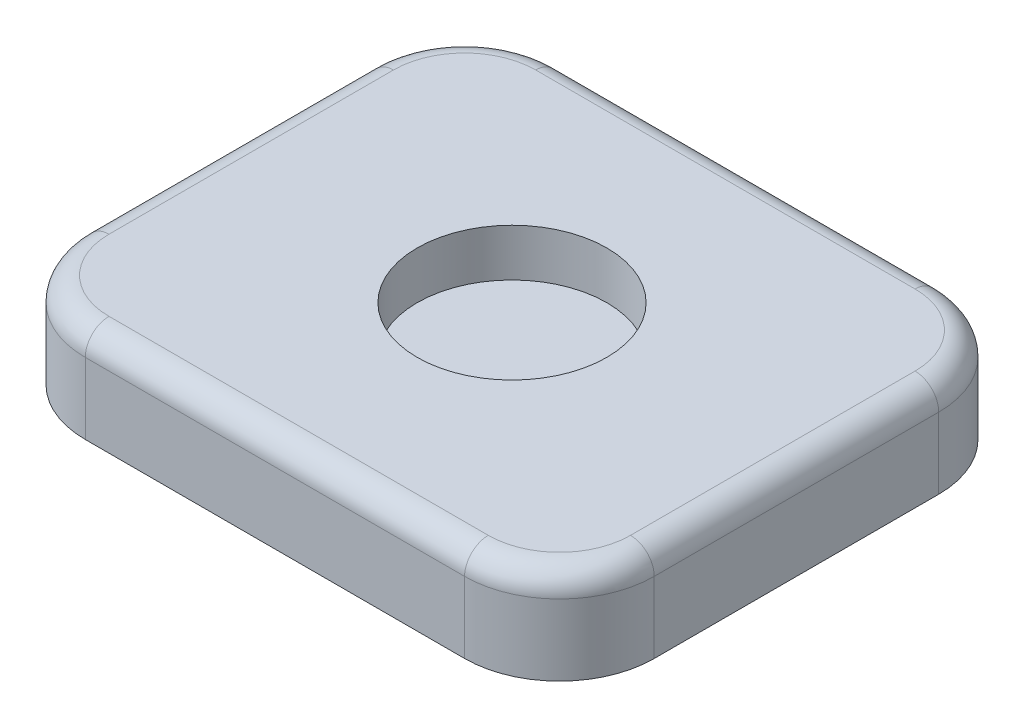
from build123d import *

# Parameters (mm, degrees)
SKETCH2_W           = 120
SKETCH2_H           = 100
SKETCH2_R           = 20
BOSS_EXTRUDE1_DEPTH = 10
SKETCH3_W           = 120
SKETCH3_H           = 100
BOSS_EXTRUDE2_DEPTH = 10
FILLET1_R           = 20
FILLET2_R           = 5


with BuildPart() as part:
    # Sketch2 → Boss-Extrude1 (new body)
    with BuildSketch(Plane(origin=(0, 0, 0), x_dir=(1, 0, 0), z_dir=(0, 1, 0))):
        Rectangle(SKETCH2_W, SKETCH2_H)
        with Locations(Location((0, 0, 0), (0, 0, 270))):
            Circle(SKETCH2_R, mode=Mode.SUBTRACT)
    extrude(amount=BOSS_EXTRUDE1_DEPTH)

    # Sketch3 → Boss-Extrude2 (add)
    with BuildSketch(Plane.XZ):
        Rectangle(SKETCH3_W, SKETCH3_H)
    extrude(amount=BOSS_EXTRUDE2_DEPTH)

    # Fillet1
    fillet1_edges = [part.edges().sort_by_distance(p)[0] for p in [
        (60, 0, 50),
        (-60, 0, 50),
        (-60, 0, -50),
        (60, 0, -50),
    ]]
    fillet(fillet1_edges, radius=FILLET1_R)

    # Fillet2
    fillet2_edges = [part.edges().sort_by_distance(p)[0] for p in [
        (-60, 10, 0),
        (0, 10, -50),
        (60, 10, 0),
        (0, 10, 50),
        (54.142135624, 10, 44.142135624),
        (54.142135624, 10, -44.142135624),
        (-54.142135624, 10, 44.142135624),
        (-54.142135624, 10, -44.142135624),
    ]]
    fillet(fillet2_edges, radius=FILLET2_R)


solid = part.part
